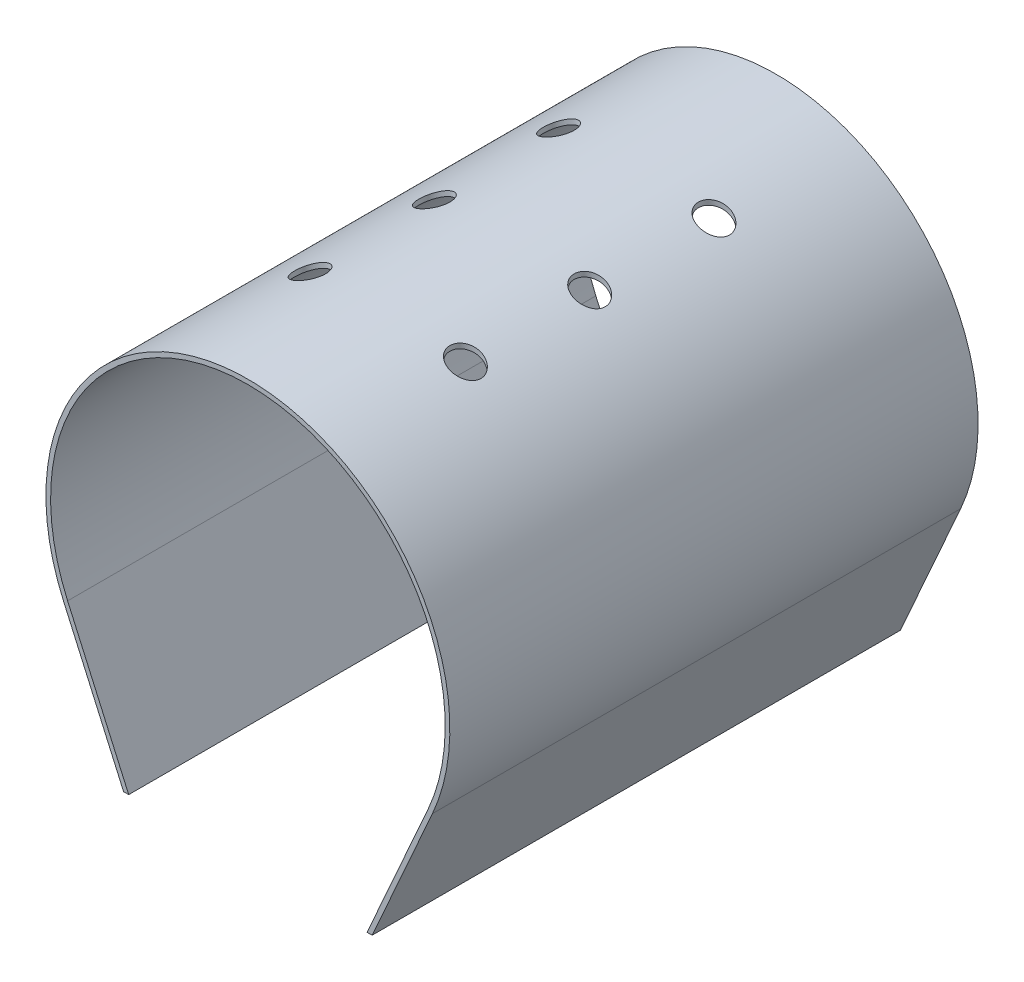
from build123d import *

# Parameters (mm, degrees)
BOSS_EXTRUDE1_DEPTH = 170
SKETCH2_R           = 5
CUT_EXTRUDE1_DEPTH  = 196


with BuildPart() as part:
    # Sketch1 → Boss-Extrude1 (new body)
    with BuildSketch(Plane.XY):
        with BuildLine():
            Line((-59.38787205, 43.578784028), (-40, 0))
            Line((-40, 0), (-38.358250656, 0))
            Line((-38.358250656, 0), (-38.629510645, 0.609720369))
            Line((-38.629510645, 0.609720369), (-58.017382695, 44.188504397))
            ThreePointArc((-58.017382695, 44.188504397), (0, 133.5), (58.017382695, 44.188504397))
            Line((58.017382695, 44.188504397), (38.629510645, 0.609720369))
            Line((38.629510645, 0.609720369), (38.358250656, 0))
            Line((38.358250656, 0), (40, 0))
            Line((40, 0), (59.38787205, 43.578784028))
            ThreePointArc((59.38787205, 43.578784028), (0, 135), (-59.38787205, 43.578784028))
        make_face()
    extrude(amount=BOSS_EXTRUDE1_DEPTH)

    # Sketch2 → Cut-Extrude1 (cut, through all)
    with BuildSketch(Plane(origin=(0, 70, 0), x_dir=(1, 0, 0), z_dir=(0, 1, 0))):
        with Locations(Location((-25, -45, 0), (0, 0, 90))):
            Circle(SKETCH2_R)
        with Locations(Location((25, -45, 0), (0, 0, 90))):
            Circle(SKETCH2_R)
        with Locations(Location((25, -85, 0), (0, 0, 90))):
            Circle(SKETCH2_R)
        with Locations(Location((25, -125, 0), (0, 0, 90))):
            Circle(SKETCH2_R)
        with Locations(Location((-25, -85, 0), (0, 0, 90))):
            Circle(SKETCH2_R)
        with Locations(Location((-25, -125, 0), (0, 0, 90))):
            Circle(SKETCH2_R)
    extrude(amount=CUT_EXTRUDE1_DEPTH, mode=Mode.SUBTRACT)


solid = part.part
